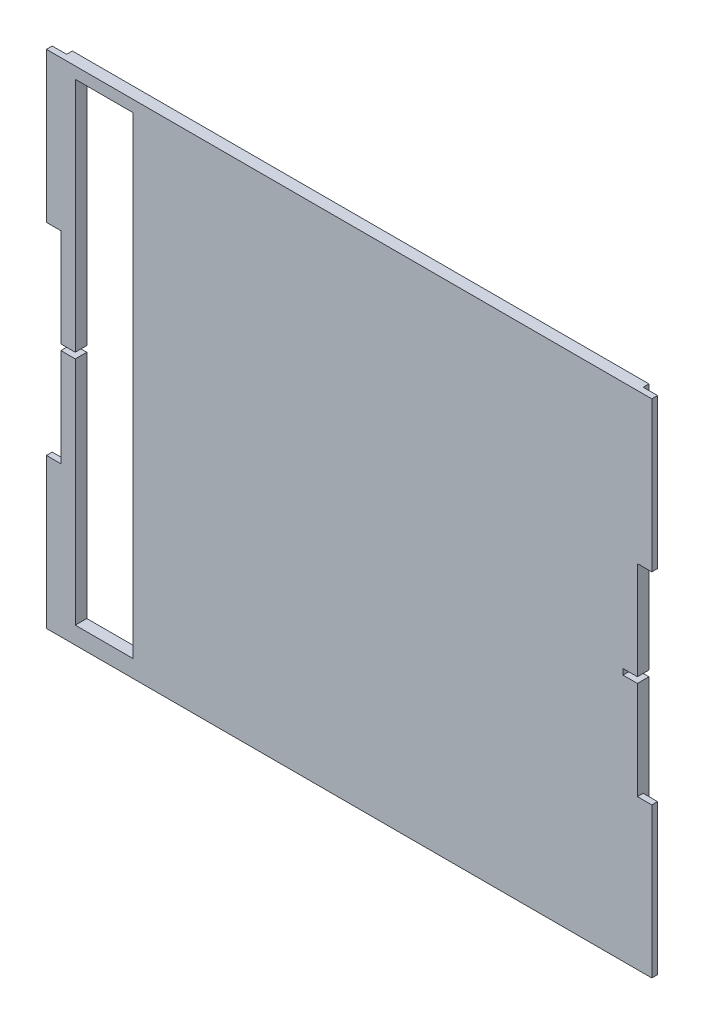
from build123d import *

# Parameters (mm, degrees)
EXTRUDE_1_DEPTH          = 2
SKETCH_2_W               = 200
SKETCH_2_H               = 174
SKETCH_2_W_2             = 20
SKETCH_2_H_2             = 164
EXTRUDE_2_DEPTH          = 2
CUT_EXTRUDE_1_DEPTH      = 137.759825972
CUT_EXTRUDE_1_DEPTH_BACK = 137.759825972
SKETCH_3_W               = 5
SKETCH_3_H               = 2


with BuildPart() as part:
    # 草图1 → 凸台-拉伸1 (new body)
    with BuildSketch(Plane.XY):
        Polygon((104.5, 35), (104.5, 87), (-105.5, 87), (-105.5, 35), (-100.5, 35), (-100.5, -35), (-105.5, -35), (-105.5, -87), (104.5, -87), (104.5, -35), (99.5, -35), (99.5, 35), align=None)
        Polygon((-95.5, 35), (-95.5, 83), (-75.5, 83), (-75.5, -81), (-95.5, -81), align=None, mode=Mode.SUBTRACT)
    extrude(amount=EXTRUDE_1_DEPTH)

    # 草图2 → 凸台-拉伸2 (add)
    with BuildSketch(Plane.XY):
        with Locations((-0.5, 0)):
            Rectangle(SKETCH_2_W, SKETCH_2_H)
        with Locations((-85.5, 1)):
            Rectangle(SKETCH_2_W_2, SKETCH_2_H_2, mode=Mode.SUBTRACT)
    extrude(amount=-EXTRUDE_2_DEPTH)

    # 草图3 → 切除-拉伸1 (cut, two sides: drawn at the far end of the back side and taken through both)
    with BuildSketch(Plane.XY.offset(-CUT_EXTRUDE_1_DEPTH_BACK)):
        with Locations((-98, 0)):
            Rectangle(SKETCH_3_W, SKETCH_3_H)
        Polygon((99.5, 0), (99.5, 1), (94.5, 1), (94.5, -1), (99.5, -1), align=None)
    extrude(amount=CUT_EXTRUDE_1_DEPTH + CUT_EXTRUDE_1_DEPTH_BACK, mode=Mode.SUBTRACT)


solid = part.part
